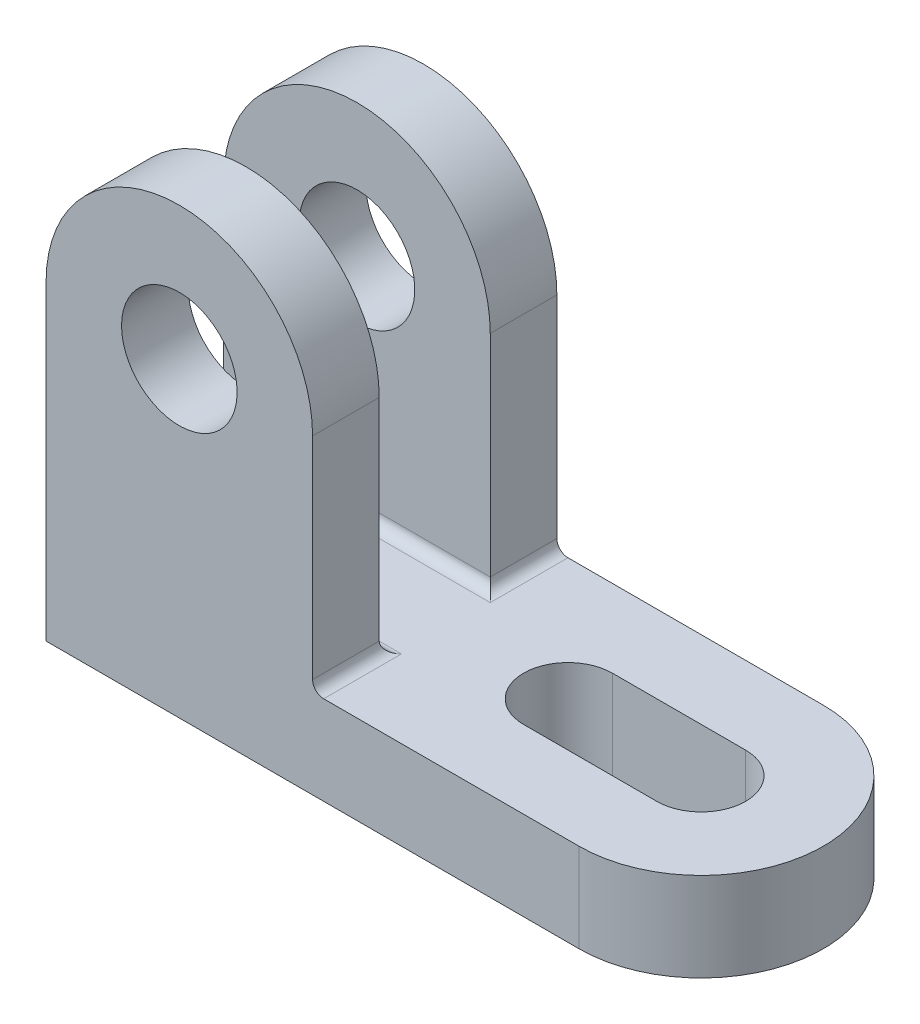
from build123d import *

# Parameters (mm, degrees)
BOSS_EXTRUDE1_DEPTH = 16
CUT_EXTRUDE2_DEPTH  = 16
BOSS_EXTRUDE2_DEPTH = 12
FILLET3_R           = 2


with BuildPart() as part:
    # Sketch4 → Boss-Extrude1 (new body)
    with BuildSketch(Plane(origin=(0, 0, 0), x_dir=(1, 0, 0), z_dir=(0, 1, 0))):
        with BuildLine():
            Line((-59, -22), (37, -22))
            ThreePointArc((37, -22), (59, 0), (37, 22))
            Line((37, 22), (-59, 22))
            Line((-59, 22), (-59, -22))
        make_face()
    extrude(amount=BOSS_EXTRUDE1_DEPTH)

    # Sketch6 → Cut-Extrude2 (cut)
    with BuildSketch(Plane(origin=(0, 16, 0), x_dir=(1, 0, 0), z_dir=(0, 1, 0))):
        with BuildLine():
            Line((37, -8), (13, -8))
            ThreePointArc((13, -8), (5, 0), (13, 8))
            Line((13, 8), (37, 8))
            ThreePointArc((37, 8), (45, 0), (37, -8))
        make_face()
    extrude(amount=-CUT_EXTRUDE2_DEPTH, mode=Mode.SUBTRACT)

    # Sketch9 → Boss-Extrude2 (add)
    with BuildSketch(Plane(origin=(0, 0, -22), x_dir=(-1, 0, 0), z_dir=(0, 0, -1))):
        with BuildLine():
            Line((11, 16), (59, 16))
            Line((59, 16), (59, 56))
            ThreePointArc((59, 56), (35, 32), (11, 56))
            Line((11, 56), (11, 16))
        make_face()
        with BuildLine():
            ThreePointArc((11, 56), (35, 32), (59, 56))
            Line((59, 56), (45.408831702, 56))
            ThreePointArc((45.408831702, 56), (35, 45.591168298), (24.591168298, 56))
            Line((24.591168298, 56), (11, 56))
        make_face()
        with BuildLine():
            Line((45.408831702, 56), (59, 56))
            ThreePointArc((59, 56), (35, 80), (11, 56))
            Line((11, 56), (24.591168298, 56))
            ThreePointArc((24.591168298, 56), (35, 66.408831702), (45.408831702, 56))
        make_face()
    boss_extrude2 = extrude(amount=-BOSS_EXTRUDE2_DEPTH)

    # Mirror5: Boss-Extrude2 across plane
    add(boss_extrude2.mirror(Plane.XY))

    # Fillet3
    fillet3_edges = [part.edges().sort_by_distance(p)[0] for p in [
        (-11, 16, -16),
        (-35, 16, -10),
        (-35, 16, 10),
        (-11, 16, 16),
    ]]
    fillet(fillet3_edges, radius=FILLET3_R)


solid = part.part
